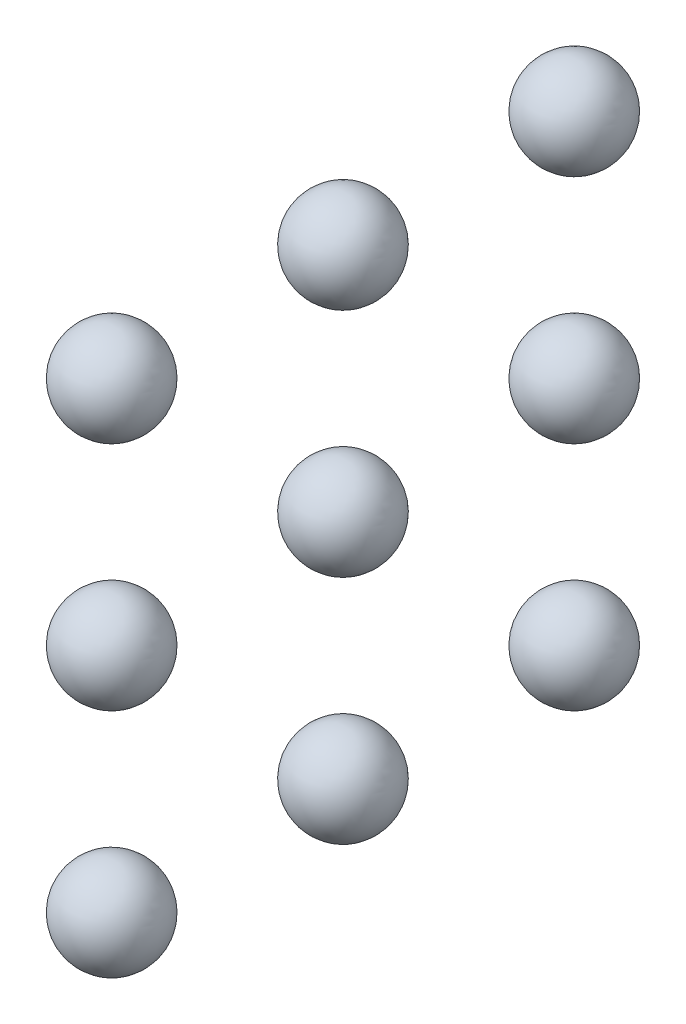
from build123d import *

# Parameters (mm, degrees)
PATTERN_LINEAR_3_COUNT   = 3
PATTERN_LINEAR_3_PITCH   = 15
PATTERN_LINEAR_3_2_COUNT = 3
PATTERN_LINEAR_3_2_PITCH = 15


with BuildPart() as part:
    # 草图2 → 旋转5 (revolve)
    with BuildSketch(Plane.XY):
        with BuildLine():
            Line((0, 3), (0, -3))
            ThreePointArc((0, -3), (-3, 0), (0, 3))
        make_face()
    revolve(axis=Axis((0, 3, 0), (0, -1, 0)))


with BuildPart() as pattern_linear_3_1:
    # 阵列(线性)3: pattern copy
    add(part.part.moved(Location(Vector(0, 0, 1) * (1 * PATTERN_LINEAR_3_PITCH))))


with BuildPart() as pattern_linear_3_2:
    # 阵列(线性)3: pattern copy
    add(part.part.moved(Location(Vector(0, 0, 1) * (2 * PATTERN_LINEAR_3_PITCH))))


with BuildPart() as pattern_linear_3_2_1:
    # Pattern Linear 3 2: pattern copy
    add(part.part.moved(Location(Vector(0, 1, 0) * (1 * PATTERN_LINEAR_3_2_PITCH))))


with BuildPart() as pattern_linear_3_2_2:
    # Pattern Linear 3 2: pattern copy
    add(part.part.moved(Location(Vector(0, 1, 0) * (2 * PATTERN_LINEAR_3_2_PITCH))))


with BuildPart() as pattern_linear_3_2_3:
    # Pattern Linear 3 2: pattern copy
    add(pattern_linear_3_1.part.moved(Location(Vector(0, 1, 0) * (1 * PATTERN_LINEAR_3_2_PITCH))))


with BuildPart() as pattern_linear_3_2_4:
    # Pattern Linear 3 2: pattern copy
    add(pattern_linear_3_1.part.moved(Location(Vector(0, 1, 0) * (2 * PATTERN_LINEAR_3_2_PITCH))))


with BuildPart() as pattern_linear_3_2_5:
    # Pattern Linear 3 2: pattern copy
    add(pattern_linear_3_2.part.moved(Location(Vector(0, 1, 0) * (1 * PATTERN_LINEAR_3_2_PITCH))))


with BuildPart() as pattern_linear_3_2_6:
    # Pattern Linear 3 2: pattern copy
    add(pattern_linear_3_2.part.moved(Location(Vector(0, 1, 0) * (2 * PATTERN_LINEAR_3_2_PITCH))))


solid = Compound([part.part, pattern_linear_3_1.part, pattern_linear_3_2.part, pattern_linear_3_2_1.part, pattern_linear_3_2_2.part, pattern_linear_3_2_3.part, pattern_linear_3_2_4.part, pattern_linear_3_2_5.part, pattern_linear_3_2_6.part])
